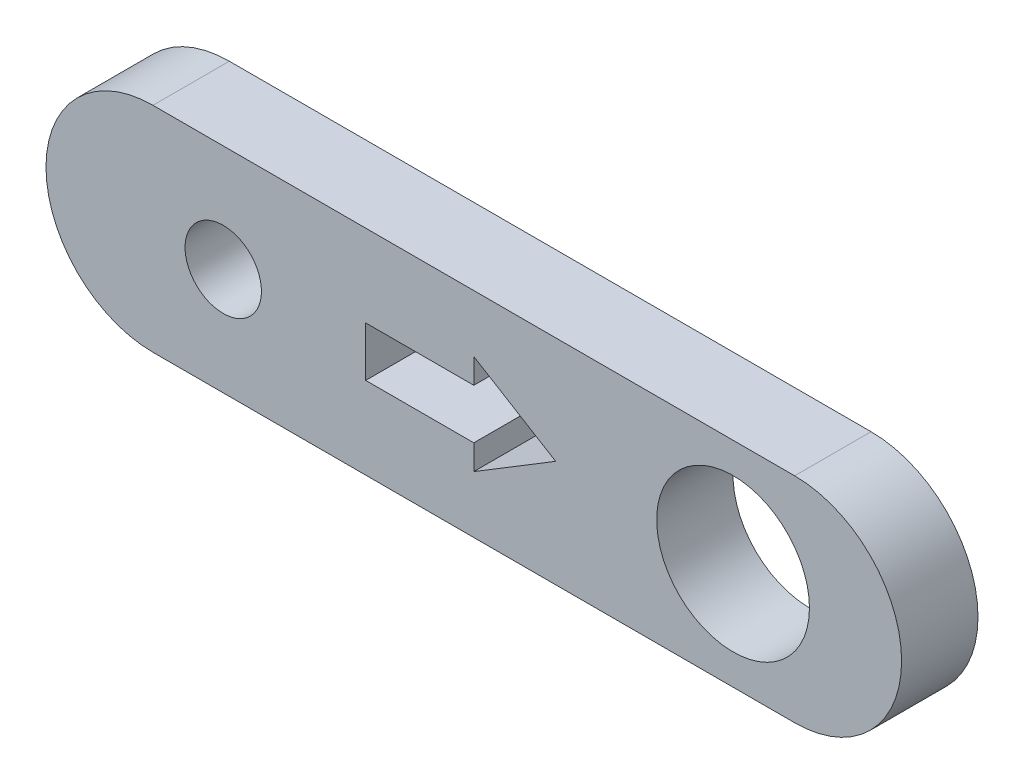
from build123d import *

# Parameters (mm, degrees)
SKETCH_1_R      = 2.5
SKETCH_1_R_2    = 5
EXTRUDE_1_DEPTH = 5


with BuildPart() as part:
    # 草圖1 → 填料-伸長1 (new body)
    with BuildSketch(Plane.XY):
        with BuildLine():
            Line((-42, -7), (0, -7))
            ThreePointArc((0, -7), (7, 0), (0, 7))
            Line((0, 7), (-42, 7))
            ThreePointArc((-42, 7), (-49, 0), (-42, -7))
        make_face()
        with Locations((-37.399198152, 0)):
            Circle(SKETCH_1_R, mode=Mode.SUBTRACT)
        Polygon((-21, 3.260013757), (-15.641541971, 0), (-21, -3.260013757), (-21, -1.630006879), (-28.07448836, -1.630006879), (-28.07448836, 1.630006879), (-21, 1.630006879), align=None, mode=Mode.SUBTRACT)
        with Locations((-4.031364092, 0)):
            Circle(SKETCH_1_R_2, mode=Mode.SUBTRACT)
    extrude(amount=EXTRUDE_1_DEPTH)


solid = part.part
